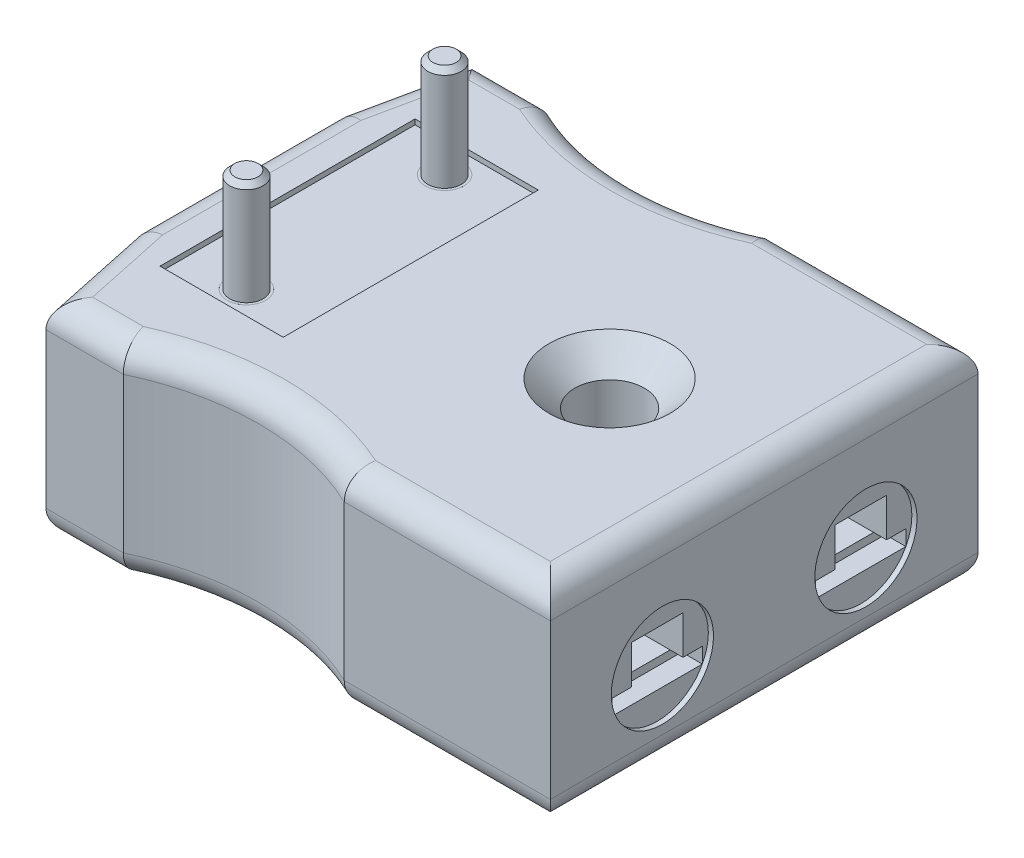
from build123d import *

# Parameters (mm, degrees)
BOSS_EXTRUDE1_DEPTH   = 8
FILLET1_R             = 1
SKETCH2_R             = 1.35
CUT_EXTRUDE1_DEPTH    = 24.518928703
CHAMFER1_SIZE         = 1
CUT_EXTRUDE2_DEPTH    = 5
SKETCH4_W             = 3.5
SKETCH4_H             = 0.3
BOSS_EXTRUDE2_DEPTH   = 4
BOSS_EXTRUDE2_2_DEPTH = 4
CUT_EXTRUDE3_REACH    = 25.519
SKETCH6_R             = 1
BOSS_EXTRUDE3_DEPTH   = 1.5
CHAMFER2_SIZE         = 0.2
CUT_EXTRUDE4_DEPTH    = 1.5
CUT_EXTRUDE4_DRAFT    = -5
FILLET2_R             = 0.2
SKETCH8_R             = 1.983401523
CUT_EXTRUDE5_DEPTH    = 0.2
SKETCH9_R             = 1.5
CUT_EXTRUDE6_DEPTH    = 0.3
BOSS_EXTRUDE5_DEPTH   = 0.3
SKETCH11_W            = 4.781356072
SKETCH11_H            = 9.9
CUT_EXTRUDE7_DEPTH    = 0.2
SKETCH12_R            = 0.75
CUT_EXTRUDE8_DEPTH    = 5.4
BOSS_EXTRUDE6_START   = 5.4
SKETCH13_R            = 0.75
BOSS_EXTRUDE6_DEPTH   = 5.4
SKETCH14_R            = 0.65
BOSS_EXTRUDE7_DEPTH   = 4
CHAMFER3_SIZE         = 0.2
CHAMFER4_SIZE         = 0.2
BOSS_EXTRUDE8_DEPTH   = 0.3


with BuildPart() as part:
    # Sketch1 → Boss-Extrude1 (new body)
    with BuildSketch(Plane(origin=(0, 0, 0), x_dir=(1, 0, 0), z_dir=(0, 1, 0))):
        with BuildLine():
            Line((0, -3.95), (0, 3.95))
            Line((0, 3.95), (0.924621043, 8.3))
            Line((0.924621043, 8.3), (3.924621043, 8.3))
            ThreePointArc((3.924621043, 8.3), (8.212310522, 7.334141848), (12.5, 8.3))
            Line((12.5, 8.3), (20.5, 8.3))
            Line((20.5, 8.3), (20.5, -8.3))
            Line((20.5, -8.3), (12.5, -8.3))
            ThreePointArc((12.5, -8.3), (8.212310522, -7.334141848), (3.924621043, -8.3))
            Line((3.924621043, -8.3), (0.924621043, -8.3))
            Line((0.924621043, -8.3), (0, -3.95))
        make_face()
    extrude(amount=BOSS_EXTRUDE1_DEPTH)

    # Fillet1
    fillet1_edges = [part.edges().sort_by_distance(p)[0] for p in [
        (0.462310522, 8, 6.125),
        (16.5, 0, -8.3),
        (20.5, 0, 0),
        (16.5, 0, 8.3),
        (8.212310522, 0, 7.334141848),
        (2.424621043, 0, 8.3),
        (0.462310522, 0, 6.125),
        (0, 0, 0),
        (0.462310522, 0, -6.125),
        (2.424621043, 8, 8.3),
        (8.212310522, 8, 7.334141848),
        (16.5, 8, 8.3),
        (20.5, 8, 0),
        (16.5, 8, -8.3),
        (8.212310522, 8, -7.334141848),
        (2.424621043, 8, -8.3),
        (0.462310522, 8, -6.125),
        (0, 8, 0),
        (2.424621043, 0, -8.3),
        (8.212310522, 0, -7.334141848),
    ]]
    fillet(fillet1_edges, radius=FILLET1_R)

    # Sketch2 → Cut-Extrude1 (cut, through all)
    with BuildSketch(Plane(origin=(0, 8, 0), x_dir=(1, 0, 0), z_dir=(0, 1, 0))):
        with Locations(Location((14.5, 0, 0), (0, 0, 270))):
            Circle(SKETCH2_R)
    extrude(amount=-CUT_EXTRUDE1_DEPTH, mode=Mode.SUBTRACT)

    # Chamfer1
    chamfer1_edges = [part.edges().sort_by_distance(p)[0] for p in [
        (14.5, 0, -1.35),
        (14.5, 8, -1.35),
    ]]
    chamfer(chamfer1_edges, length=CHAMFER1_SIZE)

    # Sketch3 → Cut-Extrude2 (cut)
    with BuildSketch(Plane.ZY.offset(-20.5)):
        Polygon((-4.95, 4.5), (-2.95, 4.5), (-2.95, 3), (-2.2, 3), (-2.2, 2.4), (-5.7, 2.4), (-5.7, 3), (-4.95, 3), align=None)
        Polygon((4.95, 3), (4.95, 4.5), (2.95, 4.5), (2.95, 3), (2.2, 3), (2.2, 2.4), (5.7, 2.4), (5.7, 3), align=None)
    extrude(amount=CUT_EXTRUDE2_DEPTH, mode=Mode.SUBTRACT)

    # Cut-Extrude3: up to this face of the body (flat: up to its plane)
    cut_extrude3_end = Plane(part.part.faces().sort_by_distance((18, 2.4, 3.95))[0])
    # Sketch5 → Cut-Extrude3 (cut, up to the picked face)
    with BuildSketch(Plane.XZ, mode=Mode.PRIVATE) as cut_extrude3_sk1:
        Polygon((2.75, 5.344895765), (5.75, 5.344895765), (5.75, 2.344895765), (2.75, 2.344895765), (2.75, 3.094895765), (-1.466244625, 3.094895765), (-1.466244625, 4.594895765), (2.75, 4.594895765), align=None)
    cut_extrude3_tool1 = split(extrude(cut_extrude3_sk1.sketch, amount=-CUT_EXTRUDE3_REACH, mode=Mode.PRIVATE), bisect_by=cut_extrude3_end, keep=Keep.BOTH, mode=Mode.PRIVATE)
    # Sketch5 → Cut-Extrude3 (cut, up to the picked face)
    with BuildSketch(Plane.XZ, mode=Mode.PRIVATE) as cut_extrude3_sk2:
        Polygon((-1.466244625, -4.594895765), (2.75, -4.594895765), (2.75, -5.344895765), (5.75, -5.344895765), (5.75, -2.344895765), (2.75, -2.344895765), (2.75, -3.094895765), (-1.466244625, -3.094895765), align=None)
    cut_extrude3_tool2 = split(extrude(cut_extrude3_sk2.sketch, amount=-CUT_EXTRUDE3_REACH, mode=Mode.PRIVATE), bisect_by=cut_extrude3_end, keep=Keep.BOTH, mode=Mode.PRIVATE)
    add(cut_extrude3_tool1.solids().sort_by(Axis((2.760928, 0, 3.844896), (0, 1, 0)))[0], mode=Mode.SUBTRACT)
    add(cut_extrude3_tool2.solids().sort_by(Axis((2.760928, 0, -3.844896), (0, 1, 0)))[0], mode=Mode.SUBTRACT)

    # Sketch8 → Cut-Extrude5 (cut)
    with BuildSketch(Plane.ZY.offset(-20.5)):
        with Locations(Location((3.95, 3.333478227, 0), (0, 0, 208.076180137))):
            Circle(SKETCH8_R)
        with Locations(Location((-3.95, 3.333478227, 0), (0, 0, 180))):
            Circle(SKETCH8_R)
    extrude(amount=CUT_EXTRUDE5_DEPTH, mode=Mode.SUBTRACT)

    # Sketch9 → Cut-Extrude6 (cut)
    with BuildSketch(Plane.XZ):
        with Locations(Location((17.519053187, -3.95, 0), (0, 0, 270))):
            Circle(SKETCH9_R)
        with Locations(Location((17.519053187, 3.95, 0), (0, 0, 90))):
            Circle(SKETCH9_R)
    extrude(amount=-CUT_EXTRUDE6_DEPTH, mode=Mode.SUBTRACT)

    # Sketch10 → Boss-Extrude5 (add)
    with BuildSketch(Plane.XZ.offset(-0.3)):
        Polygon((17.354573259, 3.853650738), (15.921557751, 3.853650738), (15.921557751, 4.153650738), (17.354573259, 4.153650738), (17.354573259, 5.595519481), (17.654573259, 5.595519481), (17.654573259, 4.153650738), (19.157483495, 4.153650738), (19.157483495, 3.853650738), (17.654573259, 3.853650738), (17.654573259, 2.286829894), (17.354573259, 2.286829894), align=None)
    extrude(amount=BOSS_EXTRUDE5_DEPTH)

    # Sketch11 → Cut-Extrude7 (cut)
    with BuildSketch(Plane(origin=(0, 8, 0), x_dir=(1, 0, 0), z_dir=(0, 1, 0))):
        with Locations((4.390678036, 0)):
            Rectangle(SKETCH11_W, SKETCH11_H)
    extrude(amount=-CUT_EXTRUDE7_DEPTH, mode=Mode.SUBTRACT)

    # Sketch12 → Cut-Extrude8 (cut)
    with BuildSketch(Plane(origin=(0, 7.8, 0), x_dir=(1, 0, 0), z_dir=(0, 1, 0))):
        with Locations(Location((4.25, 3.844895765, 0), (0, 0, 270))):
            Circle(SKETCH12_R)
        with Locations(Location((4.25, -3.844895765, 0), (0, 0, 270))):
            Circle(SKETCH12_R)
    extrude(amount=-CUT_EXTRUDE8_DEPTH, mode=Mode.SUBTRACT)

    # Sketch15 → Boss-Extrude8 (add)
    with BuildSketch(Plane.XZ.offset(-0.3)):
        Polygon((16.614015429, -4.413554053), (16.614015429, -4.234066874), (17.799912864, -4.234066874), (17.203759018, -3.569002771), (17.203759018, -3.310989951), (17.896066711, -4.082624566), (18.66529748, -3.234066874), (18.66529748, -3.491679053), (17.991819916, -4.234066874), (18.66529748, -4.234066874), (18.66529748, -4.413554053), align=None)
    extrude(amount=BOSS_EXTRUDE8_DEPTH)


with BuildPart() as body_2:
    # Sketch4 → Boss-Extrude2 (new body)
    with BuildSketch(Plane(origin=(15.5, 0, 0), x_dir=(0, 0, -1), z_dir=(1, 0, 0))):
        with Locations((-3.95, 2.55)):
            Rectangle(SKETCH4_W, SKETCH4_H)
    extrude(amount=BOSS_EXTRUDE2_DEPTH)


with BuildPart() as body_3:
    # Sketch4 → Boss-Extrude2 2 (new body)
    with BuildSketch(Plane(origin=(15.5, 0, 0), x_dir=(0, 0, -1), z_dir=(1, 0, 0))):
        with Locations((3.95, 2.55)):
            Rectangle(SKETCH4_W, SKETCH4_H)
    extrude(amount=BOSS_EXTRUDE2_2_DEPTH)


with BuildPart() as body_4:
    # Sketch6 → Boss-Extrude3 (new body)
    with BuildSketch(Plane.XZ.offset(-2.4)):
        with Locations(Location((4.25, 3.844895765, 0), (0, 0, 270))):
            Circle(SKETCH6_R)
    extrude(amount=BOSS_EXTRUDE3_DEPTH)

    # Chamfer2
    chamfer2_edges = [body_4.edges().sort_by_distance(p)[0] for p in [
        (4.25, 0.9, 4.844895765),
    ]]
    chamfer(chamfer2_edges, length=CHAMFER2_SIZE)


with BuildPart() as cut_extrude4_tool:
    # Sketch7 → Cut-Extrude4 (with draft: the straight prism first)
    with BuildSketch(Plane.XZ.offset(-0.9)):
        Polygon((4.1, 3.059084082), (4.4, 3.059084082), (4.4, 3.694895765), (5.035811682, 3.694895765), (5.035811682, 3.994895765), (4.4, 3.994895765), (4.4, 4.630707447), (4.1, 4.630707447), (4.1, 3.994895765), (3.464188318, 3.994895765), (3.464188318, 3.694895765), (4.1, 3.694895765), align=None)
    extrude(amount=-CUT_EXTRUDE4_DEPTH)
    # Cut-Extrude4: the draft: its side faces are tilted about the plane it starts from
    cut_extrude4_sides = [cut_extrude4_tool.faces().sort_by_distance(p)[0] for p in [
        (4.25, 1.65, 3.059084082),
        (4.4, 1.65, 3.376989924),
        (4.717905841, 1.65, 3.694895765),
        (5.035811682, 1.65, 3.844895765),
        (4.717905841, 1.65, 3.994895765),
        (4.4, 1.65, 4.312801606),
        (4.25, 1.65, 4.630707447),
        (4.1, 1.65, 4.312801606),
        (3.782094159, 1.65, 3.994895765),
        (3.464188318, 1.65, 3.844895765),
        (3.782094159, 1.65, 3.694895765),
        (4.1, 1.65, 3.376989924),
    ]]
    draft(cut_extrude4_sides, Plane.XZ.offset(-0.9), CUT_EXTRUDE4_DRAFT)


with BuildPart() as body_4_1:
    add(body_4.part)

    # Cut-Extrude4: cut by cut_extrude4_tool
    add(cut_extrude4_tool.part, mode=Mode.SUBTRACT)

    # Fillet2
    fillet2_edges = [body_4_1.edges().sort_by_distance(p)[0] for p in [
        (4.334383502, 1.65, 3.929279267),
        (4.334383502, 1.65, 3.760512262),
        (4.165616498, 1.65, 3.760512262),
        (4.165616498, 1.65, 3.929279267),
    ]]
    fillet(fillet2_edges, radius=FILLET2_R)


with BuildPart() as body_5:
    # Mirror1: mirrored copy
    add(body_4_1.part.mirror(Plane.XY))


    add(body_4_1.part)  # Boss-Extrude6 merges body 4
    # Sketch13 → Boss-Extrude6 (add)
    with BuildSketch(Plane(origin=(0, 2.4, 0), x_dir=(1, 0, 0), z_dir=(0, 1, 0)).offset(BOSS_EXTRUDE6_START)):
        with Locations(Location((4.25, 3.844895765, 0), (0, 0, 90))):
            Circle(SKETCH13_R)
        with Locations(Location((4.25, -3.844895765, 0), (0, 0, 90))):
            Circle(SKETCH13_R)
    extrude(amount=-BOSS_EXTRUDE6_DEPTH)

    # Sketch14 → Boss-Extrude7 (add)
    with BuildSketch(Plane(origin=(0, 7.8, 0), x_dir=(1, 0, 0), z_dir=(0, 1, 0))):
        with Locations(Location((4.25, -3.844895765, 0), (0, 0, 270))):
            Circle(SKETCH14_R)
        with Locations(Location((4.25, 3.844895765, 0), (0, 0, 270))):
            Circle(SKETCH14_R)
    extrude(amount=BOSS_EXTRUDE7_DEPTH)

    # Chamfer3
    chamfer3_edges = [body_5.edges().sort_by_distance(p)[0] for p in [
        (4.25, 11.8, 3.194895765),
    ]]
    chamfer(chamfer3_edges, length=CHAMFER3_SIZE)

    # Chamfer4
    chamfer4_edges = [body_5.edges().sort_by_distance(p)[0] for p in [
        (4.25, 11.8, -4.494895765),
    ]]
    chamfer(chamfer4_edges, length=CHAMFER4_SIZE)


solid = Compound([part.part, body_2.part, body_3.part, body_5.part])
